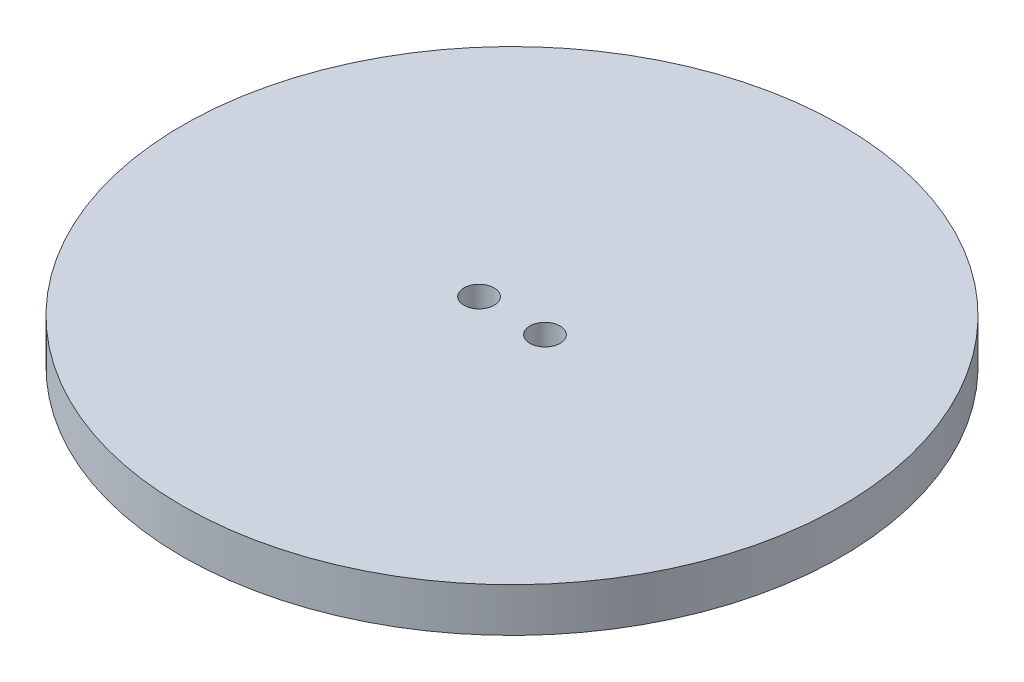
from build123d import *

# Parameters (mm, degrees)
SKETCH1_R           = 60
BOSS_EXTRUDE1_DEPTH = 8
SKETCH2_R           = 2.75
CUT_EXTRUDE1_DEPTH  = 8


with BuildPart() as part:
    # Sketch1 → Boss-Extrude1 (new body)
    with BuildSketch(Plane(origin=(0, 0, 0), x_dir=(1, 0, 0), z_dir=(0, 1, 0))):
        with Locations(Location((0, 0, 0), (0, 0, 270))):
            Circle(SKETCH1_R)
    extrude(amount=BOSS_EXTRUDE1_DEPTH)

    # Sketch2 → Cut-Extrude1 (cut)
    with BuildSketch(Plane(origin=(0, 8, 0), x_dir=(1, 0, 0), z_dir=(0, 1, 0))):
        with Locations(Location((6, 0, 0), (0, 0, 270))):
            Circle(SKETCH2_R)
        with Locations(Location((-6, 0, 0), (0, 0, 270))):
            Circle(SKETCH2_R)
    extrude(amount=-CUT_EXTRUDE1_DEPTH, mode=Mode.SUBTRACT)


solid = part.part
